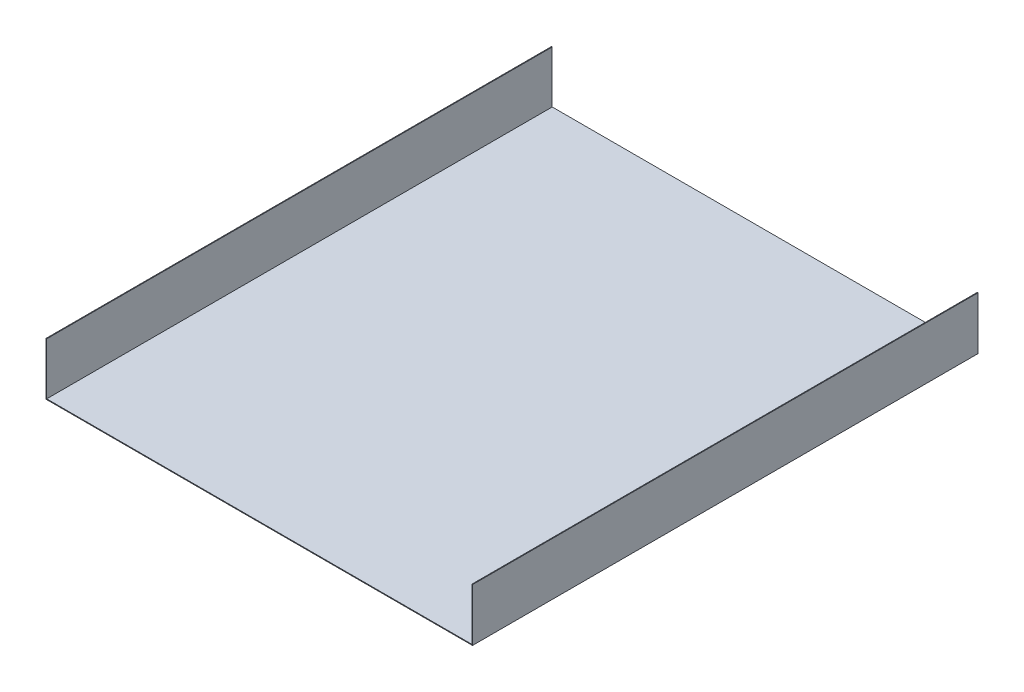
from build123d import *

# Parameters (mm, degrees)
CEK_TAZE_KUTU_U_1_0_1_DEPTH = 700


with BuildPart() as part:
    # Sketch1 → CEK_taze_kutu_U_1.0_1 (new body)
    with BuildSketch(Plane.XY):
        Polygon((13.7, 81), (13.7, 8), (604.3, 8), (604.3, 81), (603.3, 81), (603.3, 9), (14.7, 9), (14.7, 81), align=None)
    extrude(amount=-CEK_TAZE_KUTU_U_1_0_1_DEPTH)


solid = part.part
